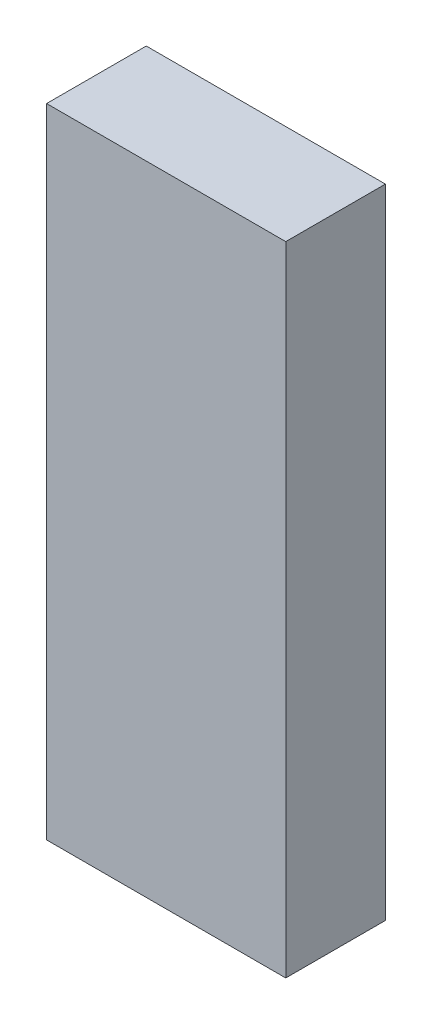
from build123d import *

# Parameters (mm, degrees)
SKETCH1_W           = 19.05
SKETCH1_H           = 50.8
BOSS_EXTRUDE1_DEPTH = 7.9375


with BuildPart() as part:
    # Sketch1 → Boss-Extrude1 (new body)
    with BuildSketch(Plane.XY):
        Rectangle(SKETCH1_W, SKETCH1_H)
    extrude(amount=BOSS_EXTRUDE1_DEPTH)


solid = part.part
